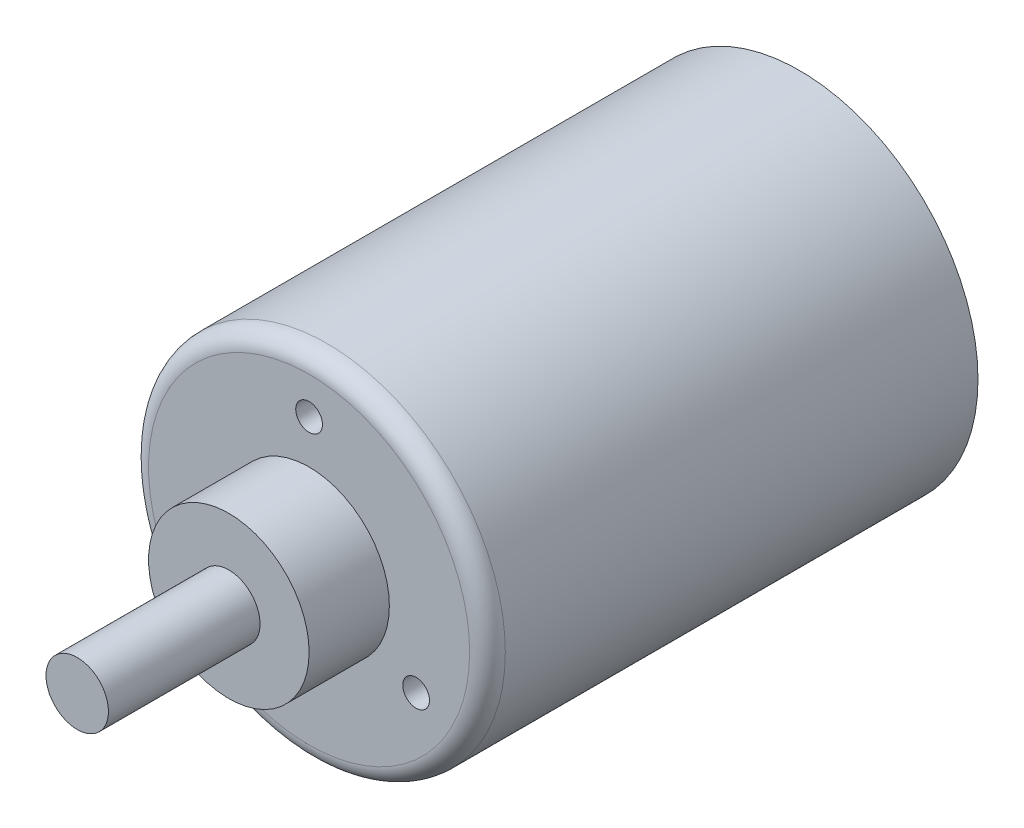
from build123d import *

# Parameters (mm, degrees)
SKETCH1_R               = 20
BOSS_EXTRUDE1_DEPTH     = 55
SKETCH3_R               = 9
BOSS_EXTRUDE2_DEPTH     = 9
CUT_EXTRUDE1_DEPTH      = 100
CUT_EXTRUDE1_DEPTH_BACK = 2
SKETCH2_R               = 3.5
SKETCH6_R               = 3.5
BOSS_EXTRUDE3_DEPTH     = 28
SKETCH7_R               = 17
CUT_EXTRUDE2_DEPTH      = 3
FILLET2_R               = 2
SKETCH8_R               = 1.5
CUT_EXTRUDE3_DEPTH      = 5


with BuildPart() as part:
    # Sketch1 → Boss-Extrude1 (new body)
    with BuildSketch(Plane.XY):
        Circle(SKETCH1_R)
    extrude(amount=BOSS_EXTRUDE1_DEPTH)

    # Sketch3 → Boss-Extrude2 (add)
    with BuildSketch(Plane.XY.offset(55)):
        Circle(SKETCH3_R)
    extrude(amount=BOSS_EXTRUDE2_DEPTH)

    # Sketch2 → Cut-Extrude1 (cut, two sides: drawn at the far end of the back side and taken through both)
    with BuildSketch(Plane.XY.offset(55).offset(-CUT_EXTRUDE1_DEPTH_BACK)):
        Circle(SKETCH2_R)
    extrude(amount=CUT_EXTRUDE1_DEPTH + CUT_EXTRUDE1_DEPTH_BACK, mode=Mode.SUBTRACT)

    # Sketch6 → Boss-Extrude3 (add)
    with BuildSketch(Plane.XY.offset(53)):
        with Locations(Location((0, 0, 0), (0, 0, 180))):
            Circle(SKETCH6_R)
    extrude(amount=BOSS_EXTRUDE3_DEPTH)

    # Sketch7 → Cut-Extrude2 (cut)
    with BuildSketch(Plane(origin=(0, 0, 0), x_dir=(-1, 0, 0), z_dir=(0, 0, -1))):
        Circle(SKETCH7_R)
    extrude(amount=-CUT_EXTRUDE2_DEPTH, mode=Mode.SUBTRACT)

    # Fillet2
    fillet2_edges = [part.edges().sort_by_distance(p)[0] for p in [
        (-20, 0, 55),
    ]]
    fillet(fillet2_edges, radius=FILLET2_R)

    # Sketch8 → Cut-Extrude3 (cut)
    with BuildSketch(Plane.XY.offset(55)):
        with Locations((0, 13.856406461)):
            Circle(SKETCH8_R)
        with Locations((-12, -6.92820323)):
            Circle(SKETCH8_R)
        with Locations((12, -6.92820323)):
            Circle(SKETCH8_R)
    extrude(amount=-CUT_EXTRUDE3_DEPTH, mode=Mode.SUBTRACT)


solid = part.part
